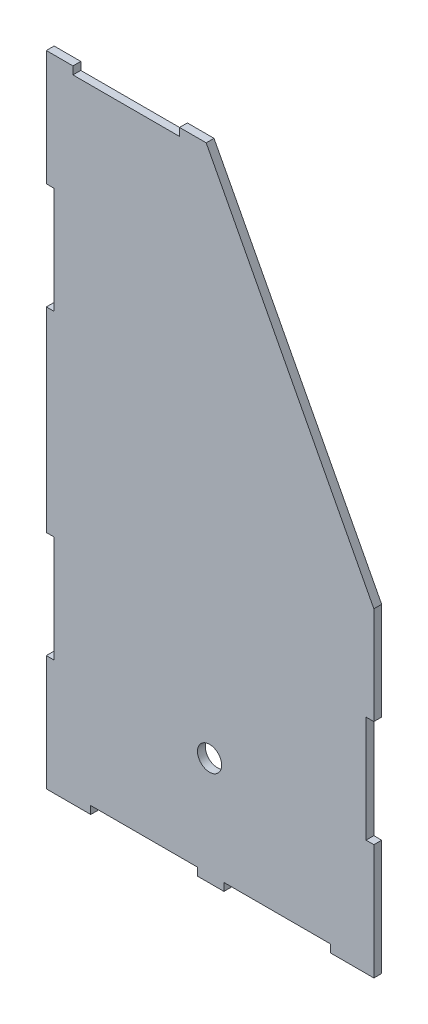
from build123d import *

# Parameters (mm, degrees)
BOSS_EXTRUDE3_DEPTH     = 5.588
SKETCH2_W               = 76.2
SKETCH2_H               = 5.588
SKETCH2_W_2             = 5.588
SKETCH2_H_2             = 76.2
CUT_EXTRUDE1_DEPTH      = 850.582717671
CUT_EXTRUDE3_DEPTH      = 850.582717671
CUT_EXTRUDE3_DEPTH_BACK = 850.582717671
SKETCH3_R               = 8.636


with BuildPart() as part:
    # Sketch1 → Boss-Extrude3 (new body)
    with BuildSketch(Plane.XY):
        Polygon((435.519883673, 642.86985555), (555.407883673, 414.26985555), (555.407883673, 185.66985555), (321.219883673, 185.66985555), (321.219883673, 642.86985555), align=None)
    extrude(amount=BOSS_EXTRUDE3_DEPTH)

    # Sketch2 → Cut-Extrude1 (cut, through all)
    with BuildSketch(Plane.XY.offset(5.588)):
        with Locations((378.369883673, 640.07585555)):
            Rectangle(SKETCH2_W, SKETCH2_H)
        with Locations((324.013883673, 522.21985555)):
            Rectangle(SKETCH2_W_2, SKETCH2_H_2)
        with Locations((324.013883673, 306.31985555)):
            Rectangle(SKETCH2_W_2, SKETCH2_H_2)
        with Locations((391.069883673, 188.46385555)):
            Rectangle(SKETCH2_W, SKETCH2_H)
        with Locations((486.319883673, 188.46385555)):
            Rectangle(SKETCH2_W, SKETCH2_H)
        with Locations((552.613883673, 306.31985555)):
            Rectangle(SKETCH2_W_2, SKETCH2_H_2)
    extrude(amount=-CUT_EXTRUDE1_DEPTH, mode=Mode.SUBTRACT)

    # Sketch3 → Cut-Extrude3 (cut, two sides: drawn at the far end of the back side and taken through both)
    with BuildSketch(Plane.XY.offset(-CUT_EXTRUDE3_DEPTH_BACK)):
        with Locations((437.932883673, 262.989065336)):
            Circle(SKETCH3_R)
    extrude(amount=CUT_EXTRUDE3_DEPTH + CUT_EXTRUDE3_DEPTH_BACK, mode=Mode.SUBTRACT)


solid = part.part
